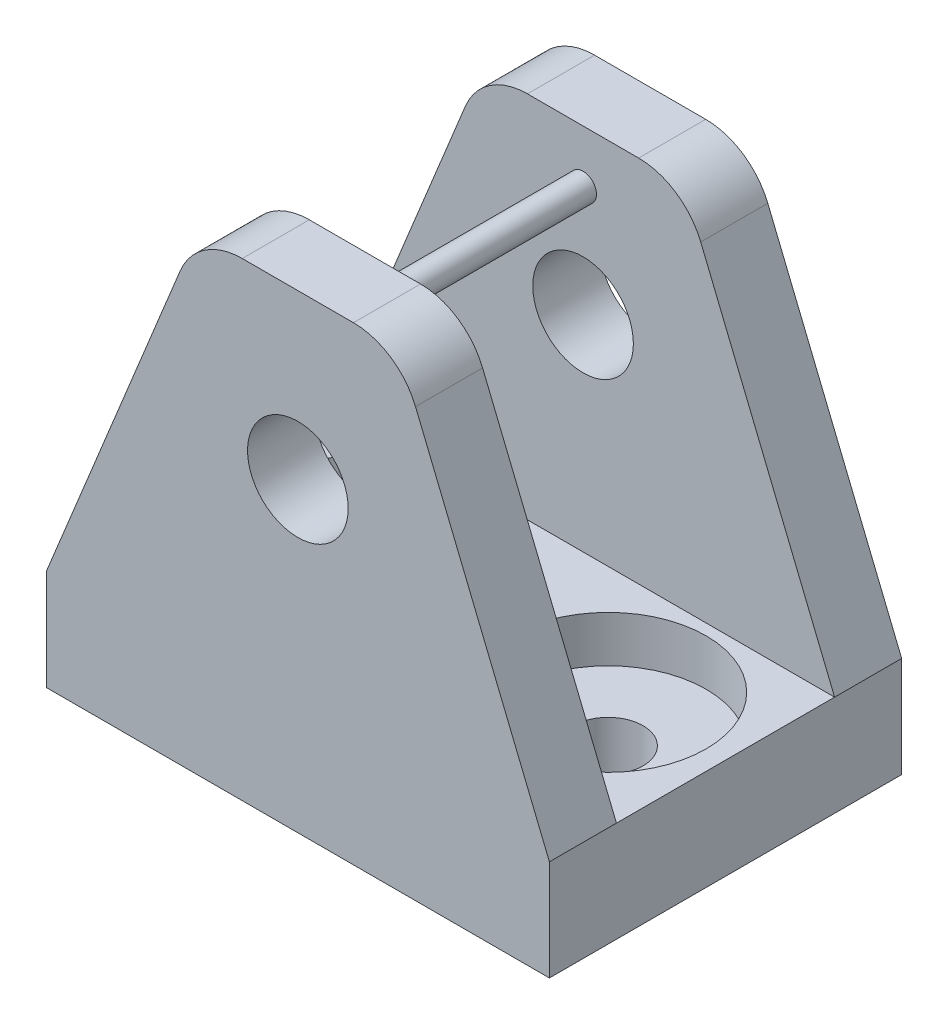
from build123d import *

# Parameters (mm, degrees)
SKETCH1_W                               = 47.625
SKETCH1_H                               = 33.3502
BOSS_EXTRUDE1_DEPTH                     = 44.45
SKETCH2_W                               = 47.625
SKETCH2_H                               = 20.6502
CUT_EXTRUDE1_DEPTH                      = 34.925
CUT_EXTRUDE2_DEPTH                      = 61.457203841
CUT_EXTRUDE2_DEPTH_BACK                 = 61.457203841
CBORE_FOR_M6_HEX_HEAD_BOLT1_D           = 6.6
CBORE_FOR_M6_HEX_HEAD_BOLT1_DEPTH       = 14.019159957
CBORE_FOR_M6_HEX_HEAD_BOLT1_CBORE_D     = 18.55
CBORE_FOR_M6_HEX_HEAD_BOLT1_CBORE_DEPTH = 4.38
CBORE_FOR_M6_HEX_HEAD_BOLT1_TIP         = 1.982840043
FILLET3_R                               = 6.35
F_3_8_0_375_DIAMETER_HOLE1_D            = 9.525
BOSS_EXTRUDE2_REACH                     = 59.2
SKETCH15_R                              = 1.27


with BuildPart() as part:
    # Sketch1 → Boss-Extrude1 (new body)
    with BuildSketch(Plane(origin=(0, 0, 0), x_dir=(1, 0, 0), z_dir=(0, 1, 0))):
        Rectangle(SKETCH1_W, SKETCH1_H)
    extrude(amount=BOSS_EXTRUDE1_DEPTH)

    # Sketch2 → Cut-Extrude1 (cut)
    with BuildSketch(Plane(origin=(0, 44.45, 0), x_dir=(1, 0, 0), z_dir=(0, 1, 0))):
        Rectangle(SKETCH2_W, SKETCH2_H)
    extrude(amount=-CUT_EXTRUDE1_DEPTH, mode=Mode.SUBTRACT)

    # Sketch3 → Cut-Extrude2 (cut, two sides: drawn at the far end of the back side and taken through both)
    with BuildSketch(Plane(origin=(0, 0, -16.6751), x_dir=(-1, 0, 0), z_dir=(0, 0, -1)).offset(-CUT_EXTRUDE2_DEPTH_BACK)):
        Polygon((23.8125, 44.45), (9.525, 44.45), (23.8125, 9.525), align=None)
        Polygon((-23.8125, 9.525), (-9.525, 44.45), (-23.8125, 44.45), align=None)
    extrude(amount=CUT_EXTRUDE2_DEPTH + CUT_EXTRUDE2_DEPTH_BACK, mode=Mode.SUBTRACT)

    # CBORE for M6 Hex Head Bolt1
    with Locations(Plane(origin=(0, 9.525, 0), x_dir=(1, 0, 0), z_dir=(0, 1, 0))):
        with Locations((-12.7, 0), (12.7, 0)):
            CounterBoreHole(CBORE_FOR_M6_HEX_HEAD_BOLT1_D / 2, CBORE_FOR_M6_HEX_HEAD_BOLT1_CBORE_D / 2, CBORE_FOR_M6_HEX_HEAD_BOLT1_CBORE_DEPTH, depth=CBORE_FOR_M6_HEX_HEAD_BOLT1_DEPTH)
            with Locations((0, 0, -(CBORE_FOR_M6_HEX_HEAD_BOLT1_DEPTH + CBORE_FOR_M6_HEX_HEAD_BOLT1_TIP / 2))):  # 118° drill point
                Cone(0, CBORE_FOR_M6_HEX_HEAD_BOLT1_D / 2, CBORE_FOR_M6_HEX_HEAD_BOLT1_TIP, mode=Mode.SUBTRACT)

    # Fillet3
    fillet3_edges = [part.edges().sort_by_distance(p)[0] for p in [
        (9.525, 44.45, 13.5001),
        (-9.525, 44.45, 13.5001),
        (9.525, 44.45, -13.5001),
        (-9.525, 44.45, -13.5001),
    ]]
    fillet(fillet3_edges, radius=FILLET3_R)

    # 3/8 (0.375) Diameter Hole1 (through all)
    with Locations(Plane.XY.offset(16.6751)):
        with Locations((0, 28.969467427)):
            Hole(F_3_8_0_375_DIAMETER_HOLE1_D / 2)

    # Sketch15 → Boss-Extrude2 (add, up to next)
    with BuildSketch(Plane.XY.offset(-10.3251), mode=Mode.PRIVATE) as boss_extrude2_sk1:
        with Locations(Location((0, 39.468275157, 0), (0, 0, 180))):
            Circle(SKETCH15_R)
    boss_extrude2_tool1 = extrude(boss_extrude2_sk1.sketch, amount=BOSS_EXTRUDE2_REACH, mode=Mode.PRIVATE) - part.part
    add(boss_extrude2_tool1.solids().sort_by_distance((0, 39.468275, -10.3251))[0])


solid = part.part
